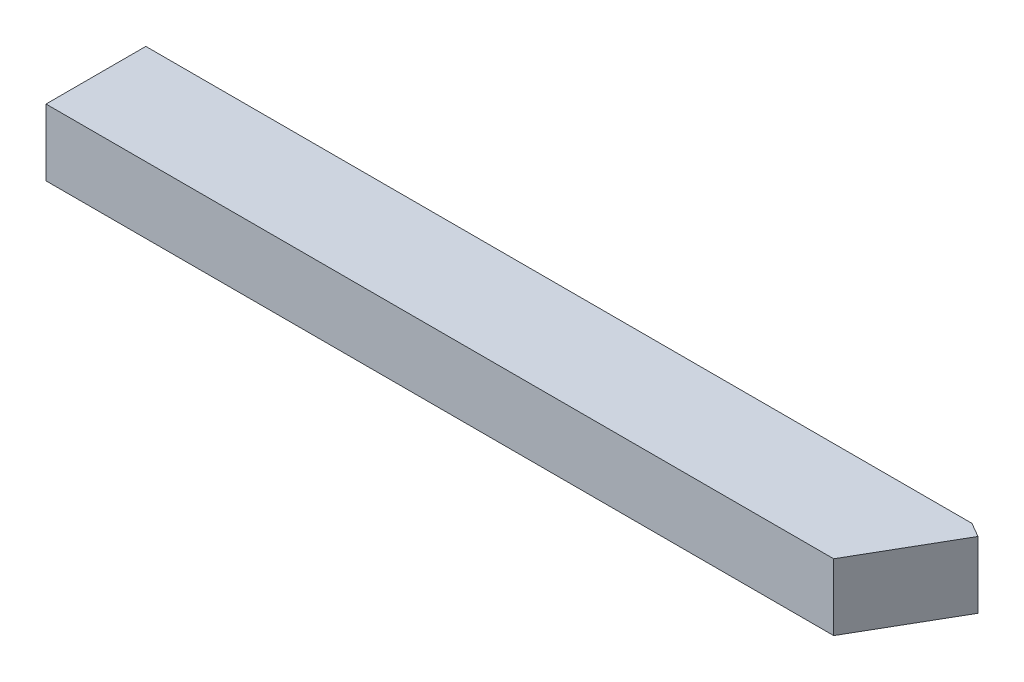
from build123d import *

# Parameters (mm, degrees)
SKETCH1_W               = 25.4
SKETCH1_H               = 25.4
BOSS_EXTRUDE1_DEPTH     = 307.975
BOSS_EXTRUDE2_DEPTH     = 25.4
CUT_EXTRUDE1_DEPTH      = 323.061066955
CUT_EXTRUDE1_DEPTH_BACK = 323.061066955
BOSS_EXTRUDE3_DEPTH     = 25.4


with BuildPart() as part:
    # Sketch1 → Boss-Extrude1 (new body)
    with BuildSketch(Plane(origin=(0, 0, 0), x_dir=(0, 0, -1), z_dir=(1, 0, 0))):
        Rectangle(SKETCH1_W, SKETCH1_H)
    extrude(amount=BOSS_EXTRUDE1_DEPTH)

    # Sketch2 → Boss-Extrude2 (add)
    with BuildSketch(Plane(origin=(0, 12.7, 0), x_dir=(1, 0, 0), z_dir=(0, 1, 0))):
        Polygon((307.975, -12.7), (320.806609733, 9.525), (320.806609733, 12.7), (307.975, 12.7), align=None)
    extrude(amount=-BOSS_EXTRUDE2_DEPTH)

    # Sketch3 → Cut-Extrude1 (cut, two sides: drawn at the far end of the back side and taken through both)
    with BuildSketch(Plane(origin=(0, 12.7, 0), x_dir=(1, 0, 0), z_dir=(0, 1, 0)).offset(-CUT_EXTRUDE1_DEPTH_BACK)):
        Polygon((320.806609733, 9.525), (315.307348419, 12.7), (320.806609733, 12.7), align=None)
    extrude(amount=CUT_EXTRUDE1_DEPTH + CUT_EXTRUDE1_DEPTH_BACK, mode=Mode.SUBTRACT)

    # Sketch4 → Boss-Extrude3 (add)
    with BuildSketch(Plane(origin=(0, 12.7, 0), x_dir=(1, 0, 0), z_dir=(0, 1, 0))):
        Polygon((0, -12.7), (0, -25.4), (300.642651581, -25.4), (307.975, -12.7), align=None)
    extrude(amount=-BOSS_EXTRUDE3_DEPTH)


solid = part.part
